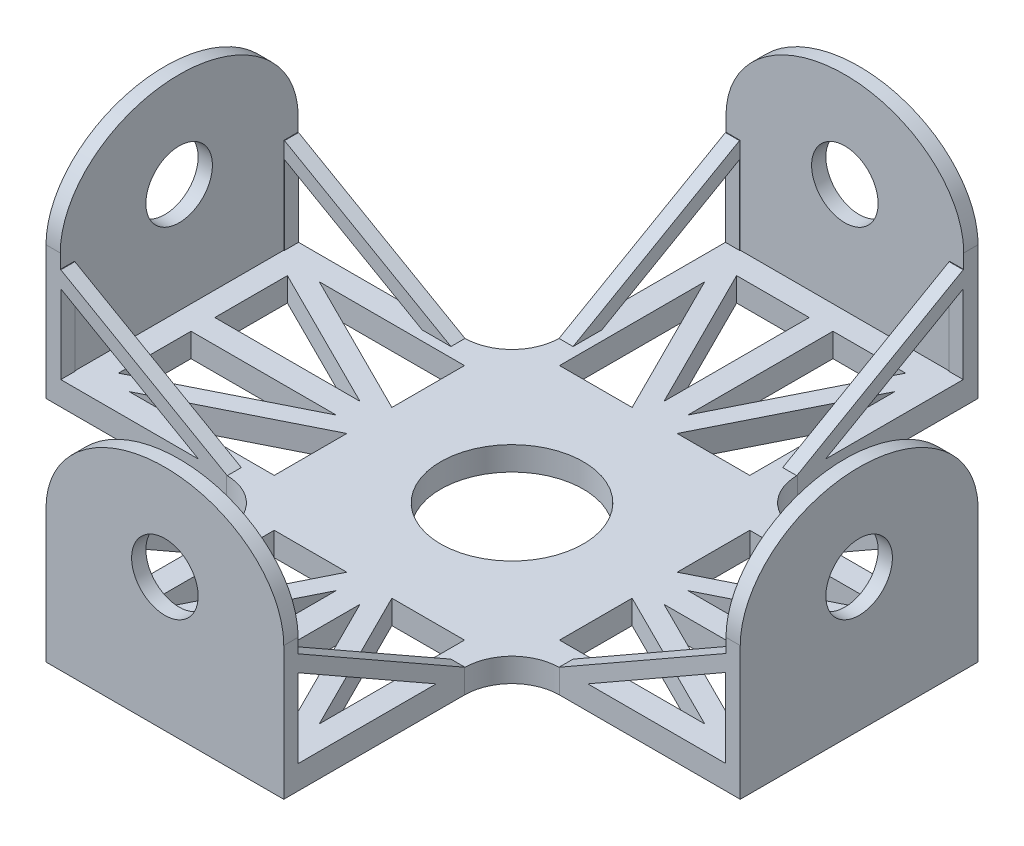
from build123d import *

# Parameters (mm, degrees)
SKETCH2_W               = 50
SKETCH2_H               = 48
BOSS_EXTRUDE2_DEPTH     = 5
SKETCH3_W               = 3
SKETCH3_H               = 50
SKETCH3_W_2             = 50
SKETCH3_H_2             = 3
BOSS_EXTRUDE3_DEPTH     = 50
CUT_EXTRUDE2_DEPTH      = 160
CUT_EXTRUDE2_DEPTH_BACK = 160
SKETCH4_R               = 7
CUT_EXTRUDE3_DEPTH      = 160
CUT_EXTRUDE3_DEPTH_BACK = 160
FILLET1_R               = 10
SKETCH8_W               = 35.113424465
SKETCH8_H               = 2.955681466
SKETCH8_W_2             = 2.955681466
SKETCH8_H_2             = 35.113424465
BOSS_EXTRUDE4_DEPTH     = 20
CUT_EXTRUDE5_DEPTH      = 100
CUT_EXTRUDE6_DEPTH      = 100
CUT_EXTRUDE8_DEPTH      = 100
CUT_EXTRUDE10_DEPTH     = 100


with BuildPart() as part:
    # Sketch2 → Boss-Extrude2 (new body)
    # profile 1 of 7: a face of its own
    with BuildSketch(Plane(origin=(0, 0, 0), x_dir=(1, 0, 0), z_dir=(0, 1, 0))):
        Polygon((-25, 25), (0, 25), (25, 25), (25, 73), (-25, 73), align=None)
        Polygon((-20, 30), (-20, 60.527864045), (-4.736067977, 30), align=None, mode=Mode.SUBTRACT)
        Polygon((-17.763932023, 65), (-2.5, 65), (-2.5, 34.472135955), align=None, mode=Mode.SUBTRACT)
        Polygon((20, 48.083701363), (20, 30), (4.736067977, 30), (20, 60.527864045), align=None, mode=Mode.SUBTRACT)
        Polygon((2.5, 65), (17.763932023, 65), (2.5, 34.472135955), align=None, mode=Mode.SUBTRACT)
    # profile 2 of 7: a face of its own
    with BuildSketch(Plane(origin=(0, 0, 0), x_dir=(1, 0, 0), z_dir=(0, 1, 0))):
        Polygon((25, 25), (25, 0), (25, -25), (73, -25), (73, 25), align=None)
        Polygon((30, -4.736067977), (60.527864045, -20), (30, -20), align=None, mode=Mode.SUBTRACT)
        Polygon((34.472135955, -2.5), (65, -2.5), (65, -17.763932023), align=None, mode=Mode.SUBTRACT)
        Polygon((60.527864045, 20), (30, 4.736067977), (30, 20), (48.083701363, 20), align=None, mode=Mode.SUBTRACT)
        Polygon((34.472135955, 2.5), (65, 17.763932023), (65, 2.5), align=None, mode=Mode.SUBTRACT)
    # profile 3 of 7: a face of its own
    with BuildSketch(Plane(origin=(0, 0, 0), x_dir=(1, 0, 0), z_dir=(0, 1, 0))):
        with Locations((0, -49)):
            Rectangle(SKETCH2_W, SKETCH2_H)
        Polygon((-2.5, -65), (-17.763932023, -65), (-2.5, -34.472135955), align=None, mode=Mode.SUBTRACT)
        Polygon((-20, -48.083701363), (-20, -30), (-4.736067977, -30), (-20, -60.527864045), align=None, mode=Mode.SUBTRACT)
        Polygon((17.763932023, -65), (2.5, -65), (2.5, -34.472135955), align=None, mode=Mode.SUBTRACT)
        Polygon((20, -30), (20, -60.527864045), (4.736067977, -30), align=None, mode=Mode.SUBTRACT)
    # profile 4 of 7: a face of its own
    with BuildSketch(Plane(origin=(0, 0, 0), x_dir=(1, 0, 0), z_dir=(0, 1, 0))):
        Polygon((-25, -25), (-25, 0), (-25, 25), (-73, 25), (-73, -25), align=None)
        Polygon((-34.472135955, -2.5), (-65, -17.763932023), (-65, -2.5), align=None, mode=Mode.SUBTRACT)
        Polygon((-30, -20), (-48.083701363, -20), (-60.527864045, -20), (-30, -4.736067977), align=None, mode=Mode.SUBTRACT)
        Polygon((-34.472135955, 2.5), (-65, 2.5), (-65, 17.763932023), align=None, mode=Mode.SUBTRACT)
        Polygon((-30, 4.736067977), (-60.527864045, 20), (-30, 20), align=None, mode=Mode.SUBTRACT)
    # profile 5 of 7: a face of its own
    with BuildSketch(Plane(origin=(0, 0, 0), x_dir=(1, 0, 0), z_dir=(0, 1, 0))):
        with BuildLine():
            Line((25, 0), (15, 0))
            ThreePointArc((15, 0), (0, -15), (-15, 0))
            Line((-15, 0), (-25, 0))
            Line((-25, 0), (-25, -25))
            Line((-25, -25), (25, -25))
            Line((25, -25), (25, 0))
        make_face()
    # profile 6 of 7: a face of its own
    with BuildSketch(Plane(origin=(0, 0, 0), x_dir=(1, 0, 0), z_dir=(0, 1, 0))):
        with BuildLine():
            ThreePointArc((0, 15), (10.606601718, 10.606601718), (15, 0))
            Line((15, 0), (25, 0))
            Line((25, 0), (25, 25))
            Line((25, 25), (0, 25))
            Line((0, 25), (0, 15))
        make_face()
    # profile 7 of 7: a face of its own
    with BuildSketch(Plane(origin=(0, 0, 0), x_dir=(1, 0, 0), z_dir=(0, 1, 0))):
        with BuildLine():
            Line((-25, 0), (-15, 0))
            ThreePointArc((-15, 0), (-10.606601718, 10.606601718), (0, 15))
            Line((0, 15), (0, 25))
            Line((0, 25), (-25, 25))
            Line((-25, 25), (-25, 0))
        make_face()
    extrude(amount=BOSS_EXTRUDE2_DEPTH)

    # Sketch3 → Boss-Extrude3 (add)
    with BuildSketch(Plane(origin=(0, 5, 0), x_dir=(1, 0, 0), z_dir=(0, 1, 0))):
        with Locations((-71.5, 0)):
            Rectangle(SKETCH3_W, SKETCH3_H)
        with Locations((0, 71.5)):
            Rectangle(SKETCH3_W_2, SKETCH3_H_2)
        with Locations((71.5, 0)):
            Rectangle(SKETCH3_W, SKETCH3_H)
        with Locations((0, -71.5)):
            Rectangle(SKETCH3_W_2, SKETCH3_H_2)
    extrude(amount=BOSS_EXTRUDE3_DEPTH)

    # Sketch4 → Cut-Extrude2 (cut, two sides: drawn at the far end of the back side and taken through both)
    with BuildSketch(Plane.ZY.offset(-70).offset(-CUT_EXTRUDE2_DEPTH_BACK)):
        with Locations((0, 28)):
            Circle(SKETCH4_R)
        with BuildLine():
            Line((-25, 55), (-25, 28))
            add(Edge.make_bspline(
                [(25, 28), (25, 48), (0, 48), (-25, 48), (-25, 28)],
                knots=[3.141592654, 3.141592654, 3.141592654, 4.71238898, 4.71238898, 6.283185307, 6.283185307, 6.283185307], degree=2, weights=[1, 0.707106781, 1, 0.707106781, 1]))
            Line((25, 28), (25, 55))
            Line((25, 55), (-25, 55))
        make_face()
    extrude(amount=CUT_EXTRUDE2_DEPTH + CUT_EXTRUDE2_DEPTH_BACK, mode=Mode.SUBTRACT)

    # Sketch7 → Cut-Extrude3 (cut, two sides: drawn at the far end of the back side and taken through both)
    with BuildSketch(Plane(origin=(0, 0, 70), x_dir=(-1, 0, 0), z_dir=(0, 0, -1)).offset(-CUT_EXTRUDE3_DEPTH_BACK)):
        with BuildLine():
            Line((-25, 55), (-25, 28))
            add(Edge.make_bspline(
                [(0, 48), (-25, 48), (-25, 28)],
                knots=[4.71238898, 4.71238898, 4.71238898, 6.283185307, 6.283185307, 6.283185307], degree=2, weights=[1, 0.707106781, 1]))
            add(Edge.make_bspline(
                [(25, 28), (25, 48), (0, 48)],
                knots=[3.141592654, 3.141592654, 3.141592654, 4.71238898, 4.71238898, 4.71238898], degree=2, weights=[1, 0.707106781, 1]))
            Line((25, 28), (25, 55))
            Line((25, 55), (-25, 55))
        make_face()
        with BuildLine():
            ThreePointArc((0, 35), (-7, 28), (0, 21))
            Line((0, 21), (0, 28))
            Line((0, 28), (0, 35))
        make_face()
        with BuildLine():
            Line((0, 28), (0, 21))
            ThreePointArc((0, 21), (4.949747468, 23.050252532), (7, 28))
            ThreePointArc((7, 28), (4.949747468, 32.949747468), (0, 35))
            Line((0, 35), (0, 28))
        make_face()
    extrude(amount=CUT_EXTRUDE3_DEPTH + CUT_EXTRUDE3_DEPTH_BACK, mode=Mode.SUBTRACT)

    # Fillet1
    fillet1_edges = [part.edges().sort_by_distance(p)[0] for p in [
        (25, 2.5, -25),
        (25, 2.5, 25),
        (-25, 2.5, 25),
        (-25, 2.5, -25),
    ]]
    fillet(fillet1_edges, radius=FILLET1_R)

    # Sketch8 → Boss-Extrude4 (add)
    with BuildSketch(Plane(origin=(0, 5, 0), x_dir=(1, 0, 0), z_dir=(0, 1, 0))):
        with Locations((52.443287767, -23.522159267)):
            Rectangle(SKETCH8_W, SKETCH8_H)
        with Locations((23.522159267, 52.443287767)):
            Rectangle(SKETCH8_W_2, SKETCH8_H_2)
        with Locations((-23.522159267, 52.443287767)):
            Rectangle(SKETCH8_W_2, SKETCH8_H_2)
        with Locations((-52.443287767, 23.522159267)):
            Rectangle(SKETCH8_W, SKETCH8_H)
        with Locations((-52.443287767, -23.522159267)):
            Rectangle(SKETCH8_W, SKETCH8_H)
        with Locations((23.522159267, -52.443287767)):
            Rectangle(SKETCH8_W_2, SKETCH8_H_2)
        with Locations((52.443287767, 23.522159267)):
            Rectangle(SKETCH8_W, SKETCH8_H)
        with Locations((-23.522159267, -52.443287767)):
            Rectangle(SKETCH8_W_2, SKETCH8_H_2)
    extrude(amount=BOSS_EXTRUDE4_DEPTH)

    # Sketch9 → Cut-Extrude5 (cut)
    with BuildSketch(Plane(origin=(0, 0, -25), x_dir=(-1, 0, 0), z_dir=(0, 0, -1))):
        Polygon((-34.886575535, 25), (-69.886575535, 25), (-52.386575535, 15), (-34.886575535, 5), align=None)
        Polygon((-53.87499235, 12.395270574), (-69.886575535, 21.544746679), (-69.886575535, 5), (-40.933268846, 5), align=None)
    extrude(amount=-CUT_EXTRUDE5_DEPTH, mode=Mode.SUBTRACT)

    # Sketch10 → Cut-Extrude6 (cut)
    with BuildSketch(Plane(origin=(25, 0, 0), x_dir=(0, 0, -1), z_dir=(1, 0, 0))):
        Polygon((69.886575535, 5), (69.886575535, 21.544746679), (53.87499235, 12.395270574), (40.933268846, 5), align=None)
        Polygon((52.386575535, 15), (69.886575535, 25), (34.886575535, 25), (34.886575535, 5), align=None)
    extrude(amount=-CUT_EXTRUDE6_DEPTH, mode=Mode.SUBTRACT)

    # Sketch12 → Cut-Extrude8 (cut)
    with BuildSketch(Plane.ZY.offset(25)):
        Polygon((70, 5), (70, 21.54749072), (53.928075819, 12.393200345), (40.948046726, 5), align=None)
        Polygon((70, 25), (34.886575535, 5), (34.886575535, 25), align=None)
    extrude(amount=-CUT_EXTRUDE8_DEPTH, mode=Mode.SUBTRACT)

    # Sketch14 → Cut-Extrude10 (cut)
    with BuildSketch(Plane.XY.offset(25)):
        Polygon((-53.87499235, 12.395270574), (-69.886575535, 21.544746679), (-69.886575535, 5), (-40.933268846, 5), align=None)
        Polygon((-34.886575535, 25), (-69.886575535, 25), (-52.386575535, 15), (-34.886575535, 5), align=None)
    extrude(amount=-CUT_EXTRUDE10_DEPTH, mode=Mode.SUBTRACT)


solid = part.part
